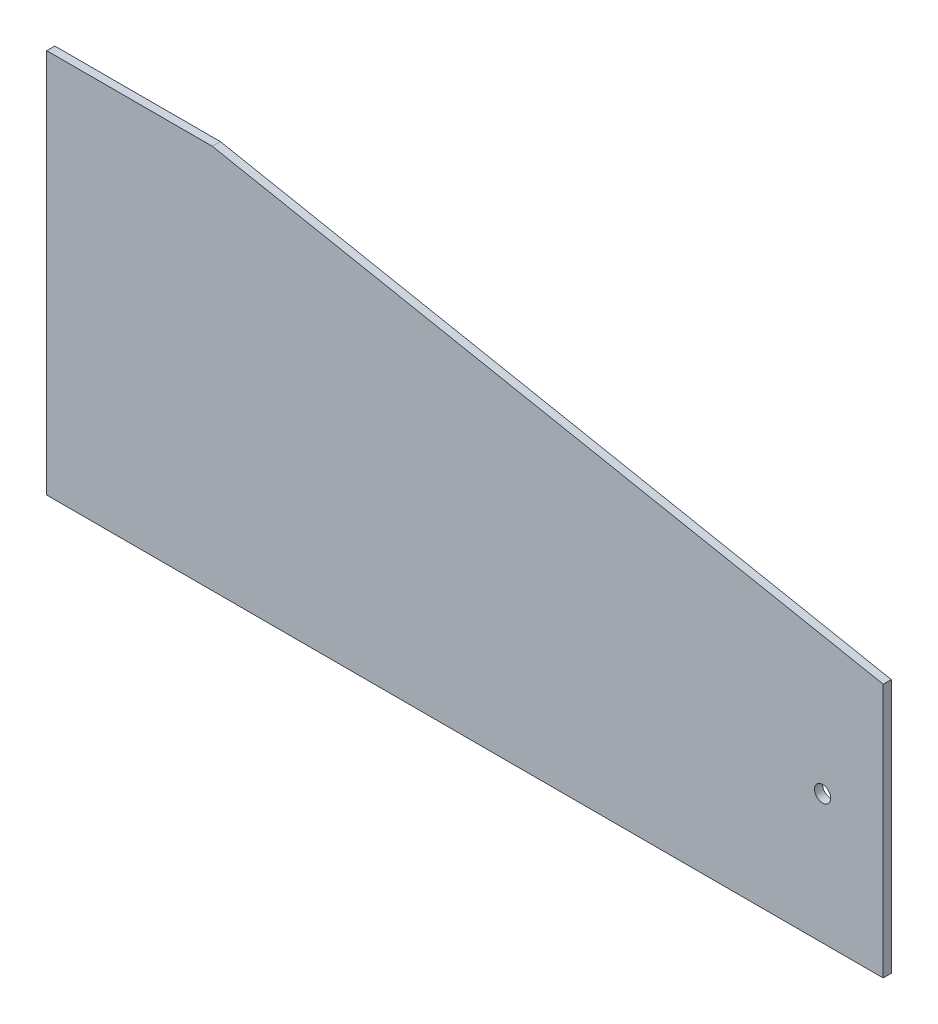
from build123d import *

# Parameters (mm, degrees)
BOSS_EXTRUDE1_DEPTH = 12.7
SKETCH2_R           = 12.7
CUT_EXTRUDE1_DEPTH  = 101.6


with BuildPart() as part:
    # Sketch1 → Boss-Extrude1 (new body)
    with BuildSketch(Plane.XY):
        Polygon((0, 0), (0, 605), (260.366426726, 605), (1315, 400), (1315, 0), align=None)
    extrude(amount=BOSS_EXTRUDE1_DEPTH)

    # Sketch2 → Cut-Extrude1 (cut)
    with BuildSketch(Plane.XY.offset(12.7)):
        with Locations((1219.75, 203.2)):
            Circle(SKETCH2_R)
    extrude(amount=-CUT_EXTRUDE1_DEPTH, mode=Mode.SUBTRACT)


solid = part.part
